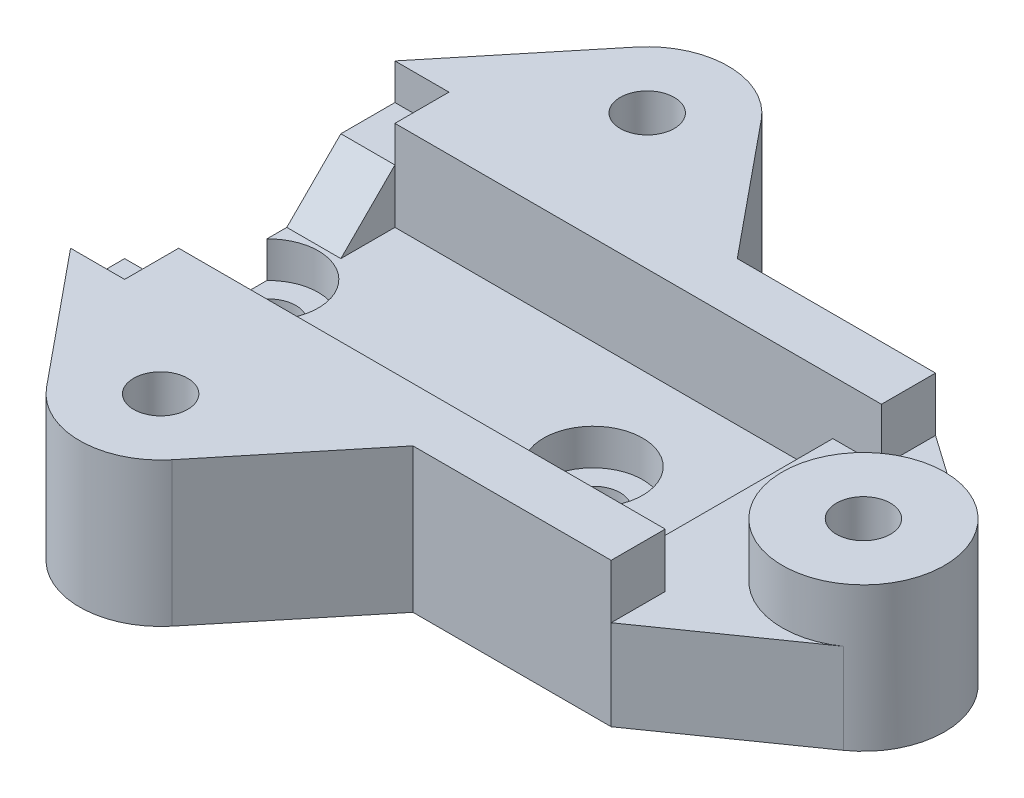
from build123d import *

# Parameters (mm, degrees)
SKETCH_1_W          = 30
SKETCH_1_H          = 18
EXTRUDE_1_DEPTH     = 3
SKETCH_2_W          = 27
SKETCH_2_H          = 3
EXTRUDE_2_DEPTH     = 5
SKETCH_3_W          = 2.7
SKETCH_3_H          = 12
EXTRUDE_3_DEPTH     = 2
SKETCH_4_R          = 4.5
SKETCH_4_R_2        = 1.5
EXTRUDE_4_DEPTH     = 8
EXTRUDE_5_DEPTH     = 5
EXTRUDE_6_DEPTH     = 3
SKETCH_11_R         = 1.5
CUT_EXTRUDE_1_DEPTH = 3
SKETCH_12_R         = 2.75
CUT_EXTRUDE_2_DEPTH = 2
EXTRUDE_7_REACH     = 29.299
SKETCH_8_R          = 1.5
SKETCH_8_R_2        = 0.75
SKETCH_13_R         = 1.5
CUT_EXTRUDE_3_DEPTH = 3
SKETCH_14_R         = 2.75
CUT_EXTRUDE_4_DEPTH = 2


with BuildPart() as part:
    # Эскиз1 → Бобышка-Вытянуть1 (new body)
    with BuildSketch(Plane(origin=(0, 0, 0), x_dir=(1, 0, 0), z_dir=(0, 1, 0))):
        Rectangle(SKETCH_1_W, SKETCH_1_H)
    extrude(amount=EXTRUDE_1_DEPTH)

    # Эскиз2 → Бобышка-Вытянуть2 (add)
    with BuildSketch(Plane(origin=(0, 3, 0), x_dir=(1, 0, 0), z_dir=(0, 1, 0))):
        with Locations((1.5, -7.5)):
            Rectangle(SKETCH_2_W, SKETCH_2_H)
        with Locations((1.5, 7.5)):
            Rectangle(SKETCH_2_W, SKETCH_2_H)
    extrude(amount=EXTRUDE_2_DEPTH)

    # Эскиз3 → Бобышка-Вытянуть3 (add)
    with BuildSketch(Plane(origin=(0, 3, 0), x_dir=(1, 0, 0), z_dir=(0, 1, 0))):
        with Locations((13.65, 0)):
            Rectangle(SKETCH_3_W, SKETCH_3_H)
    extrude(amount=EXTRUDE_3_DEPTH)



with BuildPart() as body_2:
    # Эскиз4 → Бобышка-Вытянуть4 (new body)
    with BuildSketch(Plane(origin=(0, 0, 0), x_dir=(1, 0, 0), z_dir=(0, 1, 0))):
        with Locations(Location((20, 0, 0), (0, 0, 90))):
            Circle(SKETCH_4_R)
        with Locations(Location((20, 0, 0), (0, 0, 90))):
            Circle(SKETCH_4_R_2, mode=Mode.SUBTRACT)
    extrude(amount=EXTRUDE_4_DEPTH)


with BuildPart() as part_1:
    add(part.part)

    add(body_2.part)  # Бобышка-Вытянуть5 merges body 2
    # Эскиз5 → Бобышка-Вытянуть5 (add)
    with BuildSketch(Plane.XZ):
        with BuildLine():
            Line((15, 9), (22.582879701, 3.684933167))
            ThreePointArc((22.582879701, 3.684933167), (15.5, 0), (22.582879701, -3.684933167))
            Line((22.582879701, -3.684933167), (15, -9))
            Line((15, -9), (15, 9))
        make_face()
    extrude(amount=-EXTRUDE_5_DEPTH)

    # Эскиз7 → Бобышка-Вытянуть6 (add)
    with BuildSketch(Plane.ZY.offset(12)):
        Polygon((9, 6), (6, 6), (3, 3), (9, 3), align=None)
        Polygon((-3, 3), (-9, 3), (-9, 6), (-6, 6), align=None)
    extrude(amount=EXTRUDE_6_DEPTH)

    # Эскиз11 → Вырез-Вытянуть1 (cut)
    with BuildSketch(Plane.XZ):
        with Locations(Location((-13, 0, 0), (0, 0, 270))):
            Circle(SKETCH_11_R)
    extrude(amount=-CUT_EXTRUDE_1_DEPTH, mode=Mode.SUBTRACT)

    # Эскиз12 → Вырез-Вытянуть2 (cut)
    with BuildSketch(Plane(origin=(0, 3, 0), x_dir=(1, 0, 0), z_dir=(0, 1, 0))):
        with Locations((-13, 0)):
            Circle(SKETCH_12_R)
    extrude(amount=-CUT_EXTRUDE_2_DEPTH, mode=Mode.SUBTRACT)

    # Бобышка-Вытянуть7: up to this face of the body (flat: up to its plane)
    extrude_7_end = Plane(part_1.part.faces().sort_by_distance((1.5, 8, 7.5))[0])
    # Эскиз8 → Бобышка-Вытянуть7 (add, up to the picked face)
    with BuildSketch(Plane(origin=(0, 0, 0), x_dir=(1, 0, 0), z_dir=(0, 1, 0)), mode=Mode.PRIVATE) as extrude_7_sk1:
        with BuildLine():
            Line((-1.468642293, 11.500461294), (-0.958237769, 9))
            Line((-0.958237769, 9), (4, 9))
            Line((4, 9), (-2.018099548, 16.350678733))
            ThreePointArc((-2.018099548, 16.350678733), (-1.262161398, 15.013513786), (-1, 13.5))
            ThreePointArc((-1, 13.5), (-1.118726801, 12.473138199), (-1.468642293, 11.500461294))
        make_face()
    extrude_7_tool1 = split(extrude(extrude_7_sk1.sketch, amount=EXTRUDE_7_REACH, mode=Mode.PRIVATE), bisect_by=extrude_7_end, keep=Keep.BOTH, mode=Mode.PRIVATE)
    # Эскиз8 → Бобышка-Вытянуть7 (add, up to the picked face)
    with BuildSketch(Plane(origin=(0, 0, 0), x_dir=(1, 0, 0), z_dir=(0, 1, 0)), mode=Mode.PRIVATE) as extrude_7_sk2:
        with BuildLine():
            ThreePointArc((-2.018099548, 16.350678733), (-2.284344125, 16.647944931), (-2.575877789, 16.920454545))
            ThreePointArc((-2.575877789, 16.920454545), (-2.568033415, 16.885273128), (-2.560612309, 16.85))
            Line((-2.560612309, 16.85), (-1.468642293, 11.500461294))
            ThreePointArc((-1.468642293, 11.500461294), (-1.118726801, 12.473138199), (-1, 13.5))
            ThreePointArc((-1, 13.5), (-1.262161398, 15.013513786), (-2.018099548, 16.350678733))
        make_face()
    extrude_7_tool2 = split(extrude(extrude_7_sk2.sketch, amount=EXTRUDE_7_REACH, mode=Mode.PRIVATE), bisect_by=extrude_7_end, keep=Keep.BOTH, mode=Mode.PRIVATE)
    # Эскиз8 → Бобышка-Вытянуть7 (add, up to the picked face)
    with BuildSketch(Plane(origin=(0, 0, 0), x_dir=(1, 0, 0), z_dir=(0, 1, 0)), mode=Mode.PRIVATE) as extrude_7_sk3:
        with BuildLine():
            ThreePointArc((-2.575877789, 16.920454545), (-5.5, 18), (-8.424122211, 16.920454545))
            ThreePointArc((-8.424122211, 16.920454545), (-8.431966585, 16.885273128), (-8.439387691, 16.85))
            Line((-8.439387691, 16.85), (-9.531357707, 11.500461294))
            ThreePointArc((-9.531357707, 11.500461294), (-7.871927046, 9.675871068), (-5.5, 9))
            ThreePointArc((-5.5, 9), (-3.128072954, 9.675871068), (-1.468642293, 11.500461294))
            Line((-1.468642293, 11.500461294), (-2.560612309, 16.85))
            ThreePointArc((-2.560612309, 16.85), (-2.568033415, 16.885273128), (-2.575877789, 16.920454545))
        make_face()
        with Locations(Location((-5.5, 13.5, 0), (0, 0, 90))):
            Circle(SKETCH_8_R, mode=Mode.SUBTRACT)
        with Locations((-5.5, 10.416666667)):
            Circle(SKETCH_8_R_2, mode=Mode.SUBTRACT)
        with Locations((-5.5, 16.25)):
            Circle(SKETCH_8_R_2, mode=Mode.SUBTRACT)
    extrude_7_tool3 = split(extrude(extrude_7_sk3.sketch, amount=EXTRUDE_7_REACH, mode=Mode.PRIVATE), bisect_by=extrude_7_end, keep=Keep.BOTH, mode=Mode.PRIVATE)
    # Эскиз8 → Бобышка-Вытянуть7 (add, up to the picked face)
    with BuildSketch(Plane(origin=(0, 0, 0), x_dir=(1, 0, 0), z_dir=(0, 1, 0)), mode=Mode.PRIVATE) as extrude_7_sk4:
        with BuildLine():
            ThreePointArc((-1.468642293, 11.500461294), (-3.128072954, 9.675871068), (-5.5, 9))
            Line((-5.5, 9), (-0.958237769, 9))
            Line((-0.958237769, 9), (-1.468642293, 11.500461294))
        make_face()
    extrude_7_tool4 = split(extrude(extrude_7_sk4.sketch, amount=EXTRUDE_7_REACH, mode=Mode.PRIVATE), bisect_by=extrude_7_end, keep=Keep.BOTH, mode=Mode.PRIVATE)
    # Эскиз8 → Бобышка-Вытянуть7 (add, up to the picked face)
    with BuildSketch(Plane(origin=(0, 0, 0), x_dir=(1, 0, 0), z_dir=(0, 1, 0)), mode=Mode.PRIVATE) as extrude_7_sk5:
        with BuildLine():
            Line((-8.981900452, 16.350678733), (-15, 9))
            Line((-15, 9), (-10.041762231, 9))
            Line((-10.041762231, 9), (-9.531357707, 11.500461294))
            ThreePointArc((-9.531357707, 11.500461294), (-9.971399596, 14.006542846), (-8.981900452, 16.350678733))
        make_face()
    extrude_7_tool5 = split(extrude(extrude_7_sk5.sketch, amount=EXTRUDE_7_REACH, mode=Mode.PRIVATE), bisect_by=extrude_7_end, keep=Keep.BOTH, mode=Mode.PRIVATE)
    # Эскиз8 → Бобышка-Вытянуть7 (add, up to the picked face)
    with BuildSketch(Plane(origin=(0, 0, 0), x_dir=(1, 0, 0), z_dir=(0, 1, 0)), mode=Mode.PRIVATE) as extrude_7_sk6:
        with BuildLine():
            ThreePointArc((-8.424122211, 16.920454545), (-8.715655875, 16.647944931), (-8.981900452, 16.350678733))
            ThreePointArc((-8.981900452, 16.350678733), (-9.971399596, 14.006542846), (-9.531357707, 11.500461294))
            Line((-9.531357707, 11.500461294), (-8.439387691, 16.85))
            ThreePointArc((-8.439387691, 16.85), (-8.431966585, 16.885273128), (-8.424122211, 16.920454545))
        make_face()
    extrude_7_tool6 = split(extrude(extrude_7_sk6.sketch, amount=EXTRUDE_7_REACH, mode=Mode.PRIVATE), bisect_by=extrude_7_end, keep=Keep.BOTH, mode=Mode.PRIVATE)
    # Эскиз8 → Бобышка-Вытянуть7 (add, up to the picked face)
    with BuildSketch(Plane(origin=(0, 0, 0), x_dir=(1, 0, 0), z_dir=(0, 1, 0)), mode=Mode.PRIVATE) as extrude_7_sk7:
        with BuildLine():
            Line((-9.531357707, 11.500461294), (-10.041762231, 9))
            Line((-10.041762231, 9), (-5.5, 9))
            ThreePointArc((-5.5, 9), (-7.871927046, 9.675871068), (-9.531357707, 11.500461294))
        make_face()
    extrude_7_tool7 = split(extrude(extrude_7_sk7.sketch, amount=EXTRUDE_7_REACH, mode=Mode.PRIVATE), bisect_by=extrude_7_end, keep=Keep.BOTH, mode=Mode.PRIVATE)
    # Эскиз8 → Бобышка-Вытянуть7 (add, up to the picked face)
    with BuildSketch(Plane(origin=(0, 0, 0), x_dir=(1, 0, 0), z_dir=(0, 1, 0)), mode=Mode.PRIVATE) as extrude_7_sk8:
        with BuildLine():
            Line((-2.018099548, -16.350678733), (4, -9))
            Line((4, -9), (-0.958237769, -9))
            Line((-0.958237769, -9), (-1.468642293, -11.500461294))
            ThreePointArc((-1.468642293, -11.500461294), (-1.118726801, -12.473138199), (-1, -13.5))
            ThreePointArc((-1, -13.5), (-1.262161398, -15.013513786), (-2.018099548, -16.350678733))
        make_face()
    extrude_7_tool8 = split(extrude(extrude_7_sk8.sketch, amount=EXTRUDE_7_REACH, mode=Mode.PRIVATE), bisect_by=extrude_7_end, keep=Keep.BOTH, mode=Mode.PRIVATE)
    # Эскиз8 → Бобышка-Вытянуть7 (add, up to the picked face)
    with BuildSketch(Plane(origin=(0, 0, 0), x_dir=(1, 0, 0), z_dir=(0, 1, 0)), mode=Mode.PRIVATE) as extrude_7_sk9:
        with BuildLine():
            Line((-1.468642293, -11.500461294), (-0.958237769, -9))
            Line((-0.958237769, -9), (-5.5, -9))
            ThreePointArc((-5.5, -9), (-3.128072954, -9.675871068), (-1.468642293, -11.500461294))
        make_face()
    extrude_7_tool9 = split(extrude(extrude_7_sk9.sketch, amount=EXTRUDE_7_REACH, mode=Mode.PRIVATE), bisect_by=extrude_7_end, keep=Keep.BOTH, mode=Mode.PRIVATE)
    # Эскиз8 → Бобышка-Вытянуть7 (add, up to the picked face)
    with BuildSketch(Plane(origin=(0, 0, 0), x_dir=(1, 0, 0), z_dir=(0, 1, 0)), mode=Mode.PRIVATE) as extrude_7_sk10:
        with BuildLine():
            ThreePointArc((-9.531357707, -11.500461294), (-7.871927046, -9.675871068), (-5.5, -9))
            Line((-5.5, -9), (-10.041762231, -9))
            Line((-10.041762231, -9), (-9.531357707, -11.500461294))
        make_face()
    extrude_7_tool10 = split(extrude(extrude_7_sk10.sketch, amount=EXTRUDE_7_REACH, mode=Mode.PRIVATE), bisect_by=extrude_7_end, keep=Keep.BOTH, mode=Mode.PRIVATE)
    # Эскиз8 → Бобышка-Вытянуть7 (add, up to the picked face)
    with BuildSketch(Plane(origin=(0, 0, 0), x_dir=(1, 0, 0), z_dir=(0, 1, 0)), mode=Mode.PRIVATE) as extrude_7_sk11:
        with BuildLine():
            Line((-9.531357707, -11.500461294), (-10.041762231, -9))
            Line((-10.041762231, -9), (-15, -9))
            Line((-15, -9), (-8.981900452, -16.350678733))
            ThreePointArc((-8.981900452, -16.350678733), (-9.971399596, -14.006542846), (-9.531357707, -11.500461294))
        make_face()
    extrude_7_tool11 = split(extrude(extrude_7_sk11.sketch, amount=EXTRUDE_7_REACH, mode=Mode.PRIVATE), bisect_by=extrude_7_end, keep=Keep.BOTH, mode=Mode.PRIVATE)
    # Эскиз8 → Бобышка-Вытянуть7 (add, up to the picked face)
    with BuildSketch(Plane(origin=(0, 0, 0), x_dir=(1, 0, 0), z_dir=(0, 1, 0)), mode=Mode.PRIVATE) as extrude_7_sk12:
        with BuildLine():
            ThreePointArc((-8.424122211, -16.920454545), (-5.5, -18), (-2.575877789, -16.920454545))
            ThreePointArc((-2.575877789, -16.920454545), (-2.568033415, -16.885273128), (-2.560612309, -16.85))
            Line((-2.560612309, -16.85), (-1.468642293, -11.500461294))
            ThreePointArc((-1.468642293, -11.500461294), (-3.128072954, -9.675871068), (-5.5, -9))
            ThreePointArc((-5.5, -9), (-7.871927046, -9.675871068), (-9.531357707, -11.500461294))
            Line((-9.531357707, -11.500461294), (-8.439387691, -16.85))
            ThreePointArc((-8.439387691, -16.85), (-8.431966585, -16.885273128), (-8.424122211, -16.920454545))
        make_face()
        with Locations(Location((-5.5, -13.5, 0), (0, 0, 90))):
            Circle(SKETCH_8_R, mode=Mode.SUBTRACT)
        with Locations((-5.5, -16.25)):
            Circle(SKETCH_8_R_2, mode=Mode.SUBTRACT)
        with Locations((-5.5, -10.416666667)):
            Circle(SKETCH_8_R_2, mode=Mode.SUBTRACT)
    extrude_7_tool12 = split(extrude(extrude_7_sk12.sketch, amount=EXTRUDE_7_REACH, mode=Mode.PRIVATE), bisect_by=extrude_7_end, keep=Keep.BOTH, mode=Mode.PRIVATE)
    # Эскиз8 → Бобышка-Вытянуть7 (add, up to the picked face)
    with BuildSketch(Plane(origin=(0, 0, 0), x_dir=(1, 0, 0), z_dir=(0, 1, 0)), mode=Mode.PRIVATE) as extrude_7_sk13:
        with BuildLine():
            ThreePointArc((-2.575877789, -16.920454545), (-2.284344125, -16.647944931), (-2.018099548, -16.350678733))
            ThreePointArc((-2.018099548, -16.350678733), (-1.262161398, -15.013513786), (-1, -13.5))
            ThreePointArc((-1, -13.5), (-1.118726801, -12.473138199), (-1.468642293, -11.500461294))
            Line((-1.468642293, -11.500461294), (-2.560612309, -16.85))
            ThreePointArc((-2.560612309, -16.85), (-2.568033415, -16.885273128), (-2.575877789, -16.920454545))
        make_face()
    extrude_7_tool13 = split(extrude(extrude_7_sk13.sketch, amount=EXTRUDE_7_REACH, mode=Mode.PRIVATE), bisect_by=extrude_7_end, keep=Keep.BOTH, mode=Mode.PRIVATE)
    # Эскиз8 → Бобышка-Вытянуть7 (add, up to the picked face)
    with BuildSketch(Plane(origin=(0, 0, 0), x_dir=(1, 0, 0), z_dir=(0, 1, 0)), mode=Mode.PRIVATE) as extrude_7_sk14:
        with BuildLine():
            ThreePointArc((-8.981900452, -16.350678733), (-8.715655875, -16.647944931), (-8.424122211, -16.920454545))
            ThreePointArc((-8.424122211, -16.920454545), (-8.431966585, -16.885273128), (-8.439387691, -16.85))
            Line((-8.439387691, -16.85), (-9.531357707, -11.500461294))
            ThreePointArc((-9.531357707, -11.500461294), (-9.971399596, -14.006542846), (-8.981900452, -16.350678733))
        make_face()
    extrude_7_tool14 = split(extrude(extrude_7_sk14.sketch, amount=EXTRUDE_7_REACH, mode=Mode.PRIVATE), bisect_by=extrude_7_end, keep=Keep.BOTH, mode=Mode.PRIVATE)
    # Эскиз8 → Бобышка-Вытянуть7 (add, up to the picked face)
    with BuildSketch(Plane(origin=(0, 0, 0), x_dir=(1, 0, 0), z_dir=(0, 1, 0)), mode=Mode.PRIVATE) as extrude_7_sk15:
        with Locations((-5.5, -10.416666667)):
            Circle(SKETCH_8_R_2)
    extrude_7_tool15 = split(extrude(extrude_7_sk15.sketch, amount=EXTRUDE_7_REACH, mode=Mode.PRIVATE), bisect_by=extrude_7_end, keep=Keep.BOTH, mode=Mode.PRIVATE)
    # Эскиз8 → Бобышка-Вытянуть7 (add, up to the picked face)
    with BuildSketch(Plane(origin=(0, 0, 0), x_dir=(1, 0, 0), z_dir=(0, 1, 0)), mode=Mode.PRIVATE) as extrude_7_sk16:
        with Locations((-5.5, -16.25)):
            Circle(SKETCH_8_R_2)
    extrude_7_tool16 = split(extrude(extrude_7_sk16.sketch, amount=EXTRUDE_7_REACH, mode=Mode.PRIVATE), bisect_by=extrude_7_end, keep=Keep.BOTH, mode=Mode.PRIVATE)
    # Эскиз8 → Бобышка-Вытянуть7 (add, up to the picked face)
    with BuildSketch(Plane(origin=(0, 0, 0), x_dir=(1, 0, 0), z_dir=(0, 1, 0)), mode=Mode.PRIVATE) as extrude_7_sk17:
        with Locations((-5.5, 16.25)):
            Circle(SKETCH_8_R_2)
    extrude_7_tool17 = split(extrude(extrude_7_sk17.sketch, amount=EXTRUDE_7_REACH, mode=Mode.PRIVATE), bisect_by=extrude_7_end, keep=Keep.BOTH, mode=Mode.PRIVATE)
    # Эскиз8 → Бобышка-Вытянуть7 (add, up to the picked face)
    with BuildSketch(Plane(origin=(0, 0, 0), x_dir=(1, 0, 0), z_dir=(0, 1, 0)), mode=Mode.PRIVATE) as extrude_7_sk18:
        with Locations((-5.5, 10.416666667)):
            Circle(SKETCH_8_R_2)
    extrude_7_tool18 = split(extrude(extrude_7_sk18.sketch, amount=EXTRUDE_7_REACH, mode=Mode.PRIVATE), bisect_by=extrude_7_end, keep=Keep.BOTH, mode=Mode.PRIVATE)
    add(extrude_7_tool1.solids().sort_by(Axis((0.540923, 0, -11.113959), (0, 1, 0)))[0])
    add(extrude_7_tool2.solids().sort_by(Axis((-1.645819, 0, -14.286747), (0, 1, 0)))[0])
    add(extrude_7_tool3.solids().sort_by(Axis((-2.133019, 0, -14.151064), (0, 1, 0)))[0])
    add(extrude_7_tool4.solids().sort_by(Axis((-2.209616, 0, -9.718622), (0, 1, 0)))[0])
    add(extrude_7_tool5.solids().sort_by(Axis((-11.540923, 0, -11.113959), (0, 1, 0)))[0])
    add(extrude_7_tool6.solids().sort_by(Axis((-9.354181, 0, -14.286747), (0, 1, 0)))[0])
    add(extrude_7_tool7.solids().sort_by(Axis((-8.790384, 0, -9.718622), (0, 1, 0)))[0])
    add(extrude_7_tool8.solids().sort_by(Axis((0.540923, 0, 11.113959), (0, 1, 0)))[0])
    add(extrude_7_tool9.solids().sort_by(Axis((-2.209616, 0, 9.718622), (0, 1, 0)))[0])
    add(extrude_7_tool10.solids().sort_by(Axis((-8.790384, 0, 9.718622), (0, 1, 0)))[0])
    add(extrude_7_tool11.solids().sort_by(Axis((-11.540923, 0, 11.113959), (0, 1, 0)))[0])
    add(extrude_7_tool12.solids().sort_by(Axis((-5.5, 0, 17.879166), (0, 1, 0)))[0])
    add(extrude_7_tool13.solids().sort_by(Axis((-1.645819, 0, 14.286747), (0, 1, 0)))[0])
    add(extrude_7_tool14.solids().sort_by(Axis((-9.354181, 0, 14.286747), (0, 1, 0)))[0])
    add(extrude_7_tool15.solids().sort_by(Axis((-5.5, 0, 10.416667), (0, 1, 0)))[0])
    add(extrude_7_tool16.solids().sort_by(Axis((-5.5, 0, 16.25), (0, 1, 0)))[0])
    add(extrude_7_tool17.solids().sort_by(Axis((-5.5, 0, -16.25), (0, 1, 0)))[0])
    add(extrude_7_tool18.solids().sort_by(Axis((-5.5, 0, -10.416667), (0, 1, 0)))[0])

    # Эскиз13 → Вырез-Вытянуть3 (cut)
    with BuildSketch(Plane.XZ):
        with Locations(Location((5, 0, 0), (0, 0, 270))):
            Circle(SKETCH_13_R)
    extrude(amount=-CUT_EXTRUDE_3_DEPTH, mode=Mode.SUBTRACT)

    # Эскиз14 → Вырез-Вытянуть4 (cut)
    with BuildSketch(Plane(origin=(0, 3, 0), x_dir=(1, 0, 0), z_dir=(0, 1, 0))):
        with Locations(Location((5, 0, 0), (0, 0, 270))):
            Circle(SKETCH_14_R)
    extrude(amount=-CUT_EXTRUDE_4_DEPTH, mode=Mode.SUBTRACT)


solid = part_1.part
